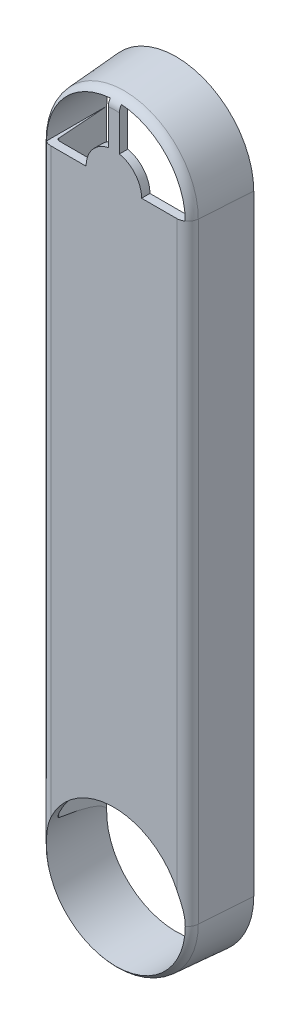
from build123d import *

# Parameters (mm, degrees)
EXTRUSION1_DEPTH        = 11.2
EXTRUSION1_TAPER        = 4
CONG_1_R                = 2
COQUE1_T                = -1.5
ENL_V_MAT_EXTRU_1_DEPTH = 128.614419248
EXTRUSION2_DEPTH        = 1
EXTRUSION3_DEPTH        = 1
EXTRUSION4_DEPTH        = 1
EXTRUSION4_2_DEPTH      = 1


with BuildPart() as part:
    # Esquisse1 → Extrusion1 (new body)
    with BuildSketch(Plane.XY):
        with BuildLine():
            ThreePointArc((0, 0), (14, -14), (28, 0))
            Line((28, 0), (28, 110))
            ThreePointArc((28, 110), (14, 124), (0, 110))
            Line((0, 110), (0, 0))
        make_face()
    extrude(amount=EXTRUSION1_DEPTH, taper=EXTRUSION1_TAPER)

    # Congé1
    cong_1_edges = [part.edges().sort_by_distance(p)[0] for p in [
        (14, 123.216819706, 11.2),
        (0.783180294, 55, 11.2),
        (14, -13.216819706, 11.2),
        (27.216819706, 55, 11.2),
    ]]
    fillet(cong_1_edges, radius=CONG_1_R)

    # Coque1
    coque1_openings = [part.faces().sort_by_distance(p)[0] for p in [
        (14, 55, 0),
    ]]
    offset(amount=COQUE1_T, openings=coque1_openings, kind=Kind.INTERSECTION)

    # Esquisse2 → Enlèv. mat.-Extru.1 (cut, through all)
    with BuildSketch(Plane.XY.offset(11.2)):
        with BuildLine():
            Line((13, 122.459935794), (13, 114.898979486))
            ThreePointArc((13, 114.898979486), (10.127016654, 113.16227766), (9, 110))
            Line((9, 110), (1.5, 110))
            ThreePointArc((1.5, 110), (4.814413465, 118.477912479), (13, 122.459935794))
        make_face()
        with BuildLine():
            Line((15, 122.459935794), (15, 114.898979486))
            ThreePointArc((15, 114.898979486), (17.872983346, 113.16227766), (19, 110))
            Line((19, 110), (26.5, 110))
            ThreePointArc((26.5, 110), (23.185586535, 118.477912479), (15, 122.459935794))
        make_face()
        with BuildLine():
            ThreePointArc((17, -12.1346611), (14, 12.5), (11, -12.1346611))
            ThreePointArc((11, -12.1346611), (14, -12.5), (17, -12.1346611))
        make_face()
    extrude(amount=-ENL_V_MAT_EXTRU_1_DEPTH, mode=Mode.SUBTRACT)

    # Esquisse4 → Extrusion2 (add)
    with BuildSketch(Plane(origin=(0, 20, 0), x_dir=(-1, 0, 0), z_dir=(0, 1, 0))):
        with BuildLine():
            Line((-23, 9.7), (-25.351789534, 9.7))
            ThreePointArc((-25.351789534, 9.7), (-25.692788714, 9.565676851), (-25.850571559, 9.234878237))
            Line((-25.850571559, 9.234878237), (-26.461373747, 0.5))
            Line((-26.461373747, 0.5), (-25.5, 0.5))
            ThreePointArc((-25.5, 0.5), (-25.146446609, 0.646446609), (-25, 1))
            Line((-25, 1), (-25, 6))
            ThreePointArc((-25, 6), (-24.853553391, 6.353553391), (-24.5, 6.5))
            Line((-24.5, 6.5), (-23.5, 6.5))
            ThreePointArc((-23.5, 6.5), (-23.146446609, 6.646446609), (-23, 7))
            Line((-23, 7), (-23, 9.7))
        make_face()
        with BuildLine():
            Line((-2.149428441, 9.234878237), (-1.538626253, 0.5))
            Line((-1.538626253, 0.5), (-2.5, 0.5))
            ThreePointArc((-2.5, 0.5), (-2.853553391, 0.646446609), (-3, 1))
            Line((-3, 1), (-3, 6))
            ThreePointArc((-3, 6), (-3.146446609, 6.353553391), (-3.5, 6.5))
            Line((-3.5, 6.5), (-4.5, 6.5))
            ThreePointArc((-4.5, 6.5), (-4.853553391, 6.646446609), (-5, 7))
            Line((-5, 7), (-5, 9.7))
            Line((-5, 9.7), (-2.648210466, 9.7))
            ThreePointArc((-2.648210466, 9.7), (-2.307211286, 9.565676851), (-2.149428441, 9.234878237))
        make_face()
    extrude(amount=EXTRUSION2_DEPTH)

    # Esquisse5 → Extrusion3 (add)
    with BuildSketch(Plane(origin=(0, 90, 0), x_dir=(-1, 0, 0), z_dir=(0, 1, 0))):
        with BuildLine():
            Line((-25.850571559, 9.234878237), (-26.461373747, 0.5))
            Line((-26.461373747, 0.5), (-25.5, 0.5))
            ThreePointArc((-25.5, 0.5), (-25.146446609, 0.646446609), (-25, 1))
            Line((-25, 1), (-25, 6))
            ThreePointArc((-25, 6), (-24.853553391, 6.353553391), (-24.5, 6.5))
            Line((-24.5, 6.5), (-23.5, 6.5))
            ThreePointArc((-23.5, 6.5), (-23.146446609, 6.646446609), (-23, 7))
            Line((-23, 7), (-23, 9.7))
            Line((-23, 9.7), (-25.351789534, 9.7))
            ThreePointArc((-25.351789534, 9.7), (-25.692788714, 9.565676851), (-25.850571559, 9.234878237))
        make_face()
        with BuildLine():
            Line((-2.648210466, 9.7), (-5, 9.7))
            Line((-5, 9.7), (-5, 7))
            ThreePointArc((-5, 7), (-4.853553391, 6.646446609), (-4.5, 6.5))
            Line((-4.5, 6.5), (-3.5, 6.5))
            ThreePointArc((-3.5, 6.5), (-3.146446609, 6.353553391), (-3, 6))
            Line((-3, 6), (-3, 1))
            ThreePointArc((-3, 1), (-2.853553391, 0.646446609), (-2.5, 0.5))
            Line((-2.5, 0.5), (-1.538626253, 0.5))
            Line((-1.538626253, 0.5), (-2.149428441, 9.234878237))
            ThreePointArc((-2.149428441, 9.234878237), (-2.307211286, 9.565676851), (-2.648210466, 9.7))
        make_face()
    extrude(amount=EXTRUSION3_DEPTH)


with BuildPart() as body_2:
    # Esquisse6 → Extrusion4 (new body)
    with BuildSketch(Plane(origin=(0, 0, 0), x_dir=(-1, 0, 0), z_dir=(0, 0, -1))):
        with BuildLine():
            Line((-16.94102449, 122.14908947), (-16.94102449, 118.854905446))
            ThreePointArc((-16.94102449, 118.854905446), (-17.028378591, 118.572552189), (-17.259917938, 118.388857791))
            ThreePointArc((-17.259917938, 118.388857791), (-20.361911425, 116.366009977), (-22.386756582, 113.265319899))
            ThreePointArc((-22.386756582, 113.265319899), (-22.573830073, 113.031710254), (-22.860812557, 112.946792581))
            Line((-22.860812557, 112.946792581), (-26.1346611, 113))
            ThreePointArc((-26.1346611, 113), (-22.81734277, 118.860274627), (-16.94102449, 122.14908947))
        make_face()
    extrude(amount=EXTRUSION4_DEPTH)


with BuildPart() as body_3:
    # Esquisse6 → Extrusion4 2 (new body)
    with BuildSketch(Plane(origin=(0, 0, 0), x_dir=(-1, 0, 0), z_dir=(0, 0, -1))):
        with BuildLine():
            Line((-10.94102449, 122.119928582), (-10.94102449, 118.808160609))
            ThreePointArc((-10.94102449, 118.808160609), (-10.855546655, 118.528569167), (-10.628338991, 118.344573209))
            ThreePointArc((-10.628338991, 118.344573209), (-7.595720212, 116.3233852), (-5.613243418, 113.265319899))
            ThreePointArc((-5.613243418, 113.265319899), (-5.426169927, 113.031710254), (-5.139187443, 112.946792581))
            Line((-5.139187443, 112.946792581), (-1.8653389, 113))
            ThreePointArc((-1.8653389, 113), (-5.139699628, 118.8173169), (-10.94102449, 122.119928582))
        make_face()
    extrude(amount=EXTRUSION4_2_DEPTH)


solid = Compound([part.part, body_2.part, body_3.part])
